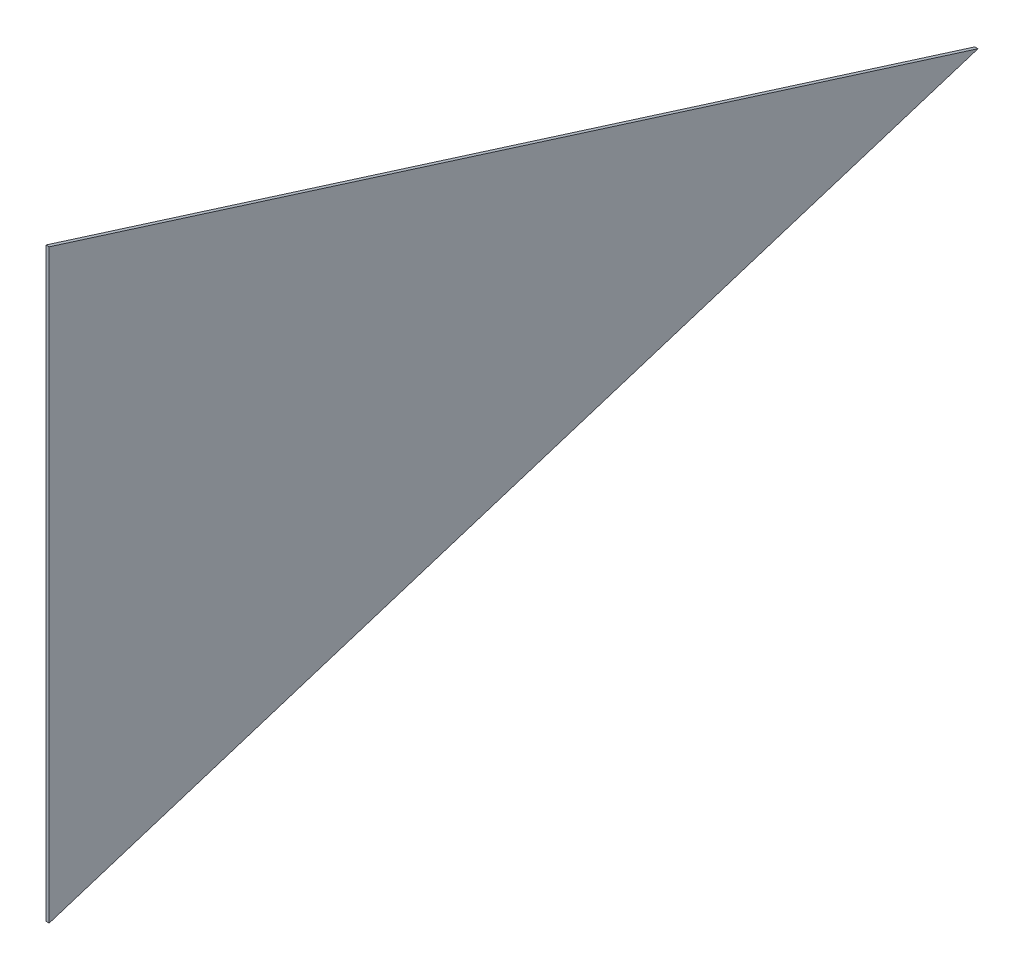
from build123d import *

# Parameters (mm, degrees)
BOSS_EXTRUDE1_DEPTH = 6.35


with BuildPart() as part:
    # Sketch1 → Boss-Extrude1 (new body)
    with BuildSketch(Plane.YZ):
        Polygon((0, 0), (-580.622719721, 1841.5), (580.622719721, 1841.5), align=None)
    extrude(amount=BOSS_EXTRUDE1_DEPTH)


solid = part.part
